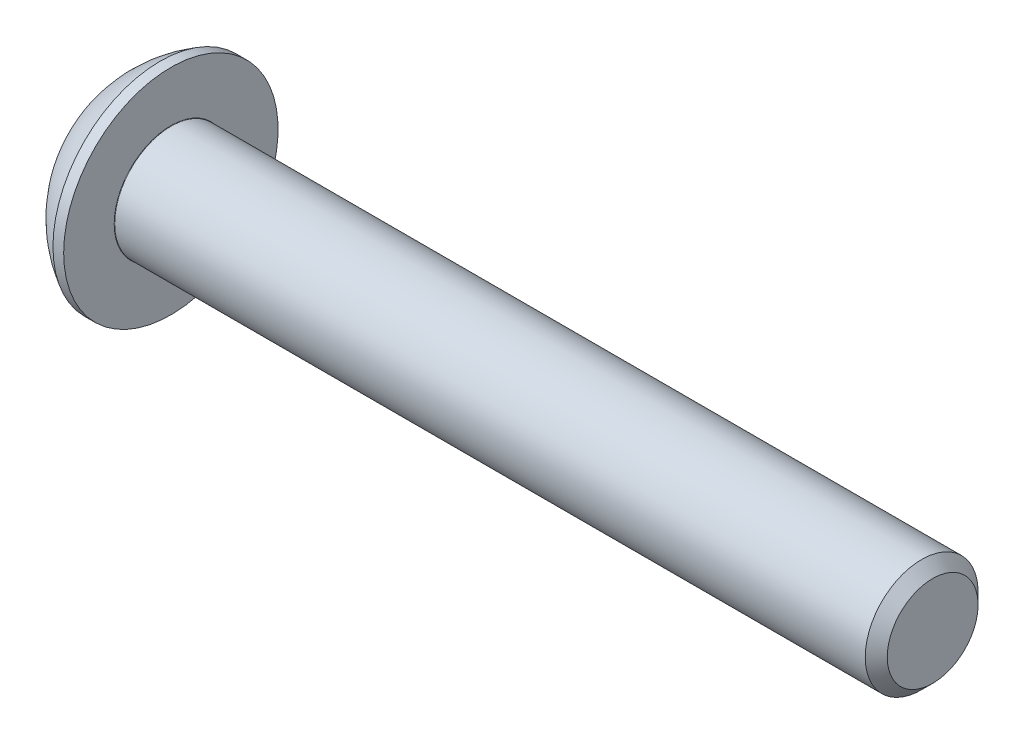
from build123d import *

# Parameters (mm, degrees)
FILLET1_R   = 0.01
HEX_2_DEPTH = 1.3


with BuildPart() as part:
    # BodySke → BaseBody (revolve)
    with BuildSketch(Plane.XY, mode=Mode.PRIVATE) as basebody_sk:
        with BuildLine():
            Line((29.2, 0), (29.2, 1.61))
            Line((29.2, 1.61), (28.81, 2))
            Line((28.81, 2), (2.2, 2))
            Line((2.2, 2), (2.2, 3.8))
            Line((2.2, 3.8), (1.82, 3.8))
            ThreePointArc((1.82, 3.8), (0.762013659, 2.991755338), (0, 1.9))
            Line((0, 1.9), (0, 0))
            Line((0, 0), (29.2, 0))
        make_face()
    revolve(basebody_sk.sketch.rotate(Axis((0, 0, 0), (1, 0, 0)), 90), axis=Axis((0, 0, 0), (1, 0, 0)))

    # Fillet1
    fillet1_edges = [part.edges().sort_by_distance(p)[0] for p in [
        (2.2, 0, -2),
    ]]
    fillet(fillet1_edges, radius=FILLET1_R)

    # Sketch2 → PreBroach (revolve, cut)
    with BuildSketch(Plane.XY, mode=Mode.PRIVATE) as prebroach_sk:
        Polygon((0, 1.25), (1.3, 1.25), (2.021687836, 0), (0, 0), align=None)
    revolve(prebroach_sk.sketch.rotate(Axis((0, 0, 0), (1, 0, 0)), 90), axis=Axis((0, 0, 0), (1, 0, 0)), mode=Mode.SUBTRACT)

    # Sketch3 → Hex 2 (cut)
    with BuildSketch(Plane(origin=(0, 0, 0), x_dir=(0, 0, -1), z_dir=(1, 0, 0))):
        Polygon((-1.25, -0.721687836), (-1.25, 0.721687836), (0, 1.443375673), (1.25, 0.721687836), (1.25, -0.721687836), (0, -1.443375673), align=None)
    extrude(amount=HEX_2_DEPTH, mode=Mode.SUBTRACT)


solid = part.part
